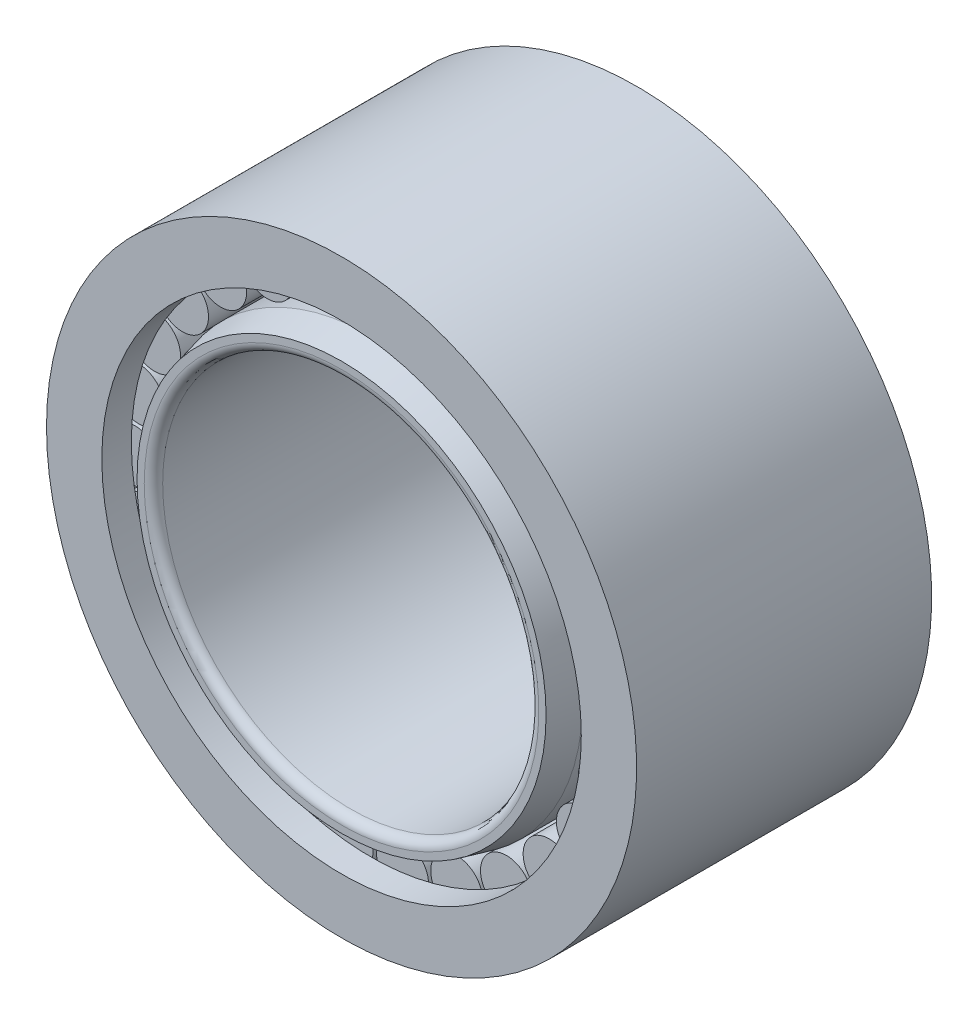
from build123d import *

# Parameters (mm, degrees)
SKETCH3_W         = 12.4
SKETCH3_H         = 1.41
CIRPATTERN1_COUNT = 27


with BuildPart() as part:
    # Sketch1 → Revolve1 (revolve)
    with BuildSketch(Plane(origin=(0, 0, 0), x_dir=(0, 0, -1), z_dir=(1, 0, 0)), mode=Mode.PRIVATE) as revolve1_sk:
        Polygon((-8, 13), (-8, 16), (8, 16), (8, 13), (6.4, 13), (6.4, 14.53), (-6.4, 14.53), (-6.4, 13), align=None)
    revolve(revolve1_sk.sketch.rotate(Axis((0, 0, -22), (0, 0, 1)), 90), axis=Axis((0, 0, -22), (0, 0, 1)))


with BuildPart() as body_2:
    # Sketch2 → Revolve2 (revolve)
    with BuildSketch(Plane(origin=(0, 0, 0), x_dir=(0, 0, -1), z_dir=(1, 0, 0)), mode=Mode.PRIVATE) as revolve2_sk:
        with BuildLine():
            Line((7.5, 10.2), (-7.5, 10.2))
            ThreePointArc((-7.5, 10.2), (-7.853553391, 10.346446609), (-8, 10.7))
            Line((-8, 10.7), (-8, 11.09))
            Line((-8, 11.09), (-6.4, 11.47))
            Line((-6.4, 11.47), (6.4, 11.47))
            Line((6.4, 11.47), (8, 11.09))
            Line((8, 11.09), (8, 10.7))
            ThreePointArc((8, 10.7), (7.853553391, 10.346446609), (7.5, 10.2))
        make_face()
    revolve(revolve2_sk.sketch.rotate(Axis((0, 0, -22), (0, 0, 1)), 90), axis=Axis((0, 0, -22), (0, 0, 1)))


with BuildPart() as body_3:
    # Sketch3 → Revolve3 (revolve)
    with BuildSketch(Plane(origin=(0, 0, 0), x_dir=(0, 0, -1), z_dir=(1, 0, 0)), mode=Mode.PRIVATE) as revolve3_sk:
        with Locations((0, 13.705)):
            Rectangle(SKETCH3_W, SKETCH3_H)
    revolve(revolve3_sk.sketch.rotate(Axis((0, 13, -6.2), (0, 0, 1)), 90), axis=Axis((0, 13, -6.2), (0, 0, 1)))


with BuildPart() as cirpattern1_1:
    # CirPattern1: pattern copy
    add(body_3.part.rotate(Axis((0, 0, 0), (0, 0, 1)), 1 * 360 / CIRPATTERN1_COUNT))


with BuildPart() as cirpattern1_2:
    # CirPattern1: pattern copy
    add(body_3.part.rotate(Axis((0, 0, 0), (0, 0, 1)), 2 * 360 / CIRPATTERN1_COUNT))


with BuildPart() as cirpattern1_3:
    # CirPattern1: pattern copy
    add(body_3.part.rotate(Axis((0, 0, 0), (0, 0, 1)), 3 * 360 / CIRPATTERN1_COUNT))


with BuildPart() as cirpattern1_4:
    # CirPattern1: pattern copy
    add(body_3.part.rotate(Axis((0, 0, 0), (0, 0, 1)), 4 * 360 / CIRPATTERN1_COUNT))


with BuildPart() as cirpattern1_5:
    # CirPattern1: pattern copy
    add(body_3.part.rotate(Axis((0, 0, 0), (0, 0, 1)), 5 * 360 / CIRPATTERN1_COUNT))


with BuildPart() as cirpattern1_6:
    # CirPattern1: pattern copy
    add(body_3.part.rotate(Axis((0, 0, 0), (0, 0, 1)), 6 * 360 / CIRPATTERN1_COUNT))


with BuildPart() as cirpattern1_7:
    # CirPattern1: pattern copy
    add(body_3.part.rotate(Axis((0, 0, 0), (0, 0, 1)), 7 * 360 / CIRPATTERN1_COUNT))


with BuildPart() as cirpattern1_8:
    # CirPattern1: pattern copy
    add(body_3.part.rotate(Axis((0, 0, 0), (0, 0, 1)), 8 * 360 / CIRPATTERN1_COUNT))


with BuildPart() as cirpattern1_9:
    # CirPattern1: pattern copy
    add(body_3.part.rotate(Axis((0, 0, 0), (0, 0, 1)), 9 * 360 / CIRPATTERN1_COUNT))


with BuildPart() as cirpattern1_10:
    # CirPattern1: pattern copy
    add(body_3.part.rotate(Axis((0, 0, 0), (0, 0, 1)), 10 * 360 / CIRPATTERN1_COUNT))


with BuildPart() as cirpattern1_11:
    # CirPattern1: pattern copy
    add(body_3.part.rotate(Axis((0, 0, 0), (0, 0, 1)), 11 * 360 / CIRPATTERN1_COUNT))


with BuildPart() as cirpattern1_12:
    # CirPattern1: pattern copy
    add(body_3.part.rotate(Axis((0, 0, 0), (0, 0, 1)), 12 * 360 / CIRPATTERN1_COUNT))


with BuildPart() as cirpattern1_13:
    # CirPattern1: pattern copy
    add(body_3.part.rotate(Axis((0, 0, 0), (0, 0, 1)), 13 * 360 / CIRPATTERN1_COUNT))


with BuildPart() as cirpattern1_14:
    # CirPattern1: pattern copy
    add(body_3.part.rotate(Axis((0, 0, 0), (0, 0, 1)), 14 * 360 / CIRPATTERN1_COUNT))


with BuildPart() as cirpattern1_15:
    # CirPattern1: pattern copy
    add(body_3.part.rotate(Axis((0, 0, 0), (0, 0, 1)), 15 * 360 / CIRPATTERN1_COUNT))


with BuildPart() as cirpattern1_16:
    # CirPattern1: pattern copy
    add(body_3.part.rotate(Axis((0, 0, 0), (0, 0, 1)), 16 * 360 / CIRPATTERN1_COUNT))


with BuildPart() as cirpattern1_17:
    # CirPattern1: pattern copy
    add(body_3.part.rotate(Axis((0, 0, 0), (0, 0, 1)), 17 * 360 / CIRPATTERN1_COUNT))


with BuildPart() as cirpattern1_18:
    # CirPattern1: pattern copy
    add(body_3.part.rotate(Axis((0, 0, 0), (0, 0, 1)), 18 * 360 / CIRPATTERN1_COUNT))


with BuildPart() as cirpattern1_19:
    # CirPattern1: pattern copy
    add(body_3.part.rotate(Axis((0, 0, 0), (0, 0, 1)), 19 * 360 / CIRPATTERN1_COUNT))


with BuildPart() as cirpattern1_20:
    # CirPattern1: pattern copy
    add(body_3.part.rotate(Axis((0, 0, 0), (0, 0, 1)), 20 * 360 / CIRPATTERN1_COUNT))


with BuildPart() as cirpattern1_21:
    # CirPattern1: pattern copy
    add(body_3.part.rotate(Axis((0, 0, 0), (0, 0, 1)), 21 * 360 / CIRPATTERN1_COUNT))


with BuildPart() as cirpattern1_22:
    # CirPattern1: pattern copy
    add(body_3.part.rotate(Axis((0, 0, 0), (0, 0, 1)), 22 * 360 / CIRPATTERN1_COUNT))


with BuildPart() as cirpattern1_23:
    # CirPattern1: pattern copy
    add(body_3.part.rotate(Axis((0, 0, 0), (0, 0, 1)), 23 * 360 / CIRPATTERN1_COUNT))


with BuildPart() as cirpattern1_24:
    # CirPattern1: pattern copy
    add(body_3.part.rotate(Axis((0, 0, 0), (0, 0, 1)), 24 * 360 / CIRPATTERN1_COUNT))


with BuildPart() as cirpattern1_25:
    # CirPattern1: pattern copy
    add(body_3.part.rotate(Axis((0, 0, 0), (0, 0, 1)), 25 * 360 / CIRPATTERN1_COUNT))


with BuildPart() as cirpattern1_26:
    # CirPattern1: pattern copy
    add(body_3.part.rotate(Axis((0, 0, 0), (0, 0, 1)), 26 * 360 / CIRPATTERN1_COUNT))


solid = Compound([part.part, body_2.part, body_3.part, cirpattern1_1.part, cirpattern1_2.part, cirpattern1_3.part, cirpattern1_4.part, cirpattern1_5.part, cirpattern1_6.part, cirpattern1_7.part, cirpattern1_8.part, cirpattern1_9.part, cirpattern1_10.part, cirpattern1_11.part, cirpattern1_12.part, cirpattern1_13.part, cirpattern1_14.part, cirpattern1_15.part, cirpattern1_16.part, cirpattern1_17.part, cirpattern1_18.part, cirpattern1_19.part, cirpattern1_20.part, cirpattern1_21.part, cirpattern1_22.part, cirpattern1_23.part, cirpattern1_24.part, cirpattern1_25.part, cirpattern1_26.part])
